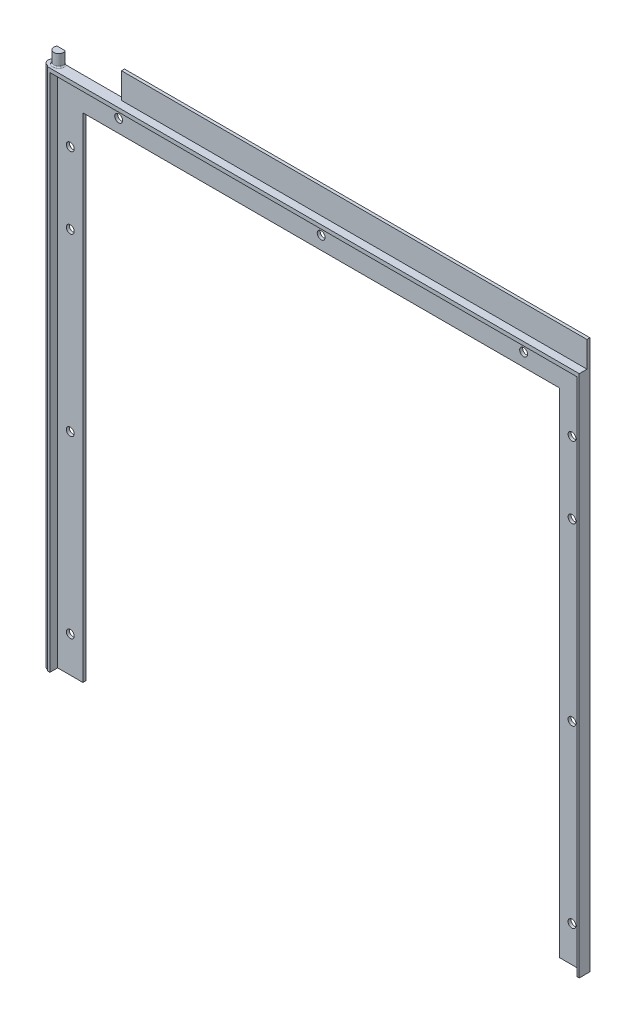
from build123d import *

# Parameters (mm, degrees)
SALIENTE_EXTRUIR1_DEPTH = 1.25
SALIENTE_EXTRUIR2_DEPTH = 3.25
SALIENTE_EXTRUIR3_DEPTH = 219.699982554
SALIENTE_EXTRUIR4_DEPTH = 5
REDONDEO1_R             = 0.5
CROQUIS7_R              = 1.65
CORTAR_EXTRUIR1_DEPTH   = 409.725190141


with BuildPart() as part:
    # Croquis1 → Saliente-Extruir1 (new body)
    with BuildSketch(Plane.XY):
        Polygon((76.151803136, 59.751000255), (76.151803136, 266.850888729), (276.149988174, 266.850888729), (276.149988174, 59.751000255), (287.750005722, 59.751000255), (287.750005722, 290.251016617), (92.349797487, 290.251016617), (92.349797487, 279.450982809), (64.949996769, 279.450982809), (64.439042354, 59.751000255), align=None)
    extrude(amount=SALIENTE_EXTRUIR1_DEPTH)

    # Croquis3 → Saliente-Extruir2 (add)
    with BuildSketch(Plane.XY.offset(1.25)):
        Polygon((65.549881, 59.751000255), (65.549881, 277.83340256), (286.749988794, 277.845112205), (286.751151675, 59.751000255), (287.750005722, 59.751000255), (287.750005722, 279.450982809), (92.349797487, 279.450982809), (64.949996769, 279.450982809), (64.439042354, 59.751000255), align=None)
    extrude(amount=SALIENTE_EXTRUIR2_DEPTH)

    # Croquis4 → Saliente-Extruir3 (add)
    with BuildSketch(Plane(origin=(0, 279.450982809, 0), x_dir=(1, 0, 0), z_dir=(0, 1, 0))):
        with BuildLine():
            Line((64.20314146, -3.994108901), (64.439042354, -4.5))
            Line((64.439042354, -4.5), (64.949996769, -4.5))
            Line((64.949996769, -4.5), (64.949996769, 0))
            Line((64.949996769, 0), (64.159257759, 0))
            ThreePointArc((64.159257759, 0), (62.250455442, -2.018267743), (64.20314146, -3.994108901))
        make_face()
    extrude(amount=-SALIENTE_EXTRUIR3_DEPTH)

    # Croquis6 → Saliente-Extruir4 (add)
    with BuildSketch(Plane(origin=(0, 279.450982809, 0), x_dir=(1, 0, 0), z_dir=(0, 1, 0))):
        with BuildLine():
            Line((67.471777384, 0), (64.029912079, 0))
            ThreePointArc((64.029912079, 0), (65.750844731, -3.019014625), (67.471777384, 0))
        make_face()
    extrude(amount=SALIENTE_EXTRUIR4_DEPTH)

    # Redondeo1
    redondeo1_edges = [part.edges().sort_by_distance(p)[0] for p in [
        (65.757057169, 279.450982809, 3.019004976),
    ]]
    fillet(redondeo1_edges, radius=REDONDEO1_R)

    # Croquis7 → Cortar-Extruir1 (cut, through all)
    with BuildSketch(Plane.XY.offset(1.25)):
        with Locations((70.850842068, 74.751000255)):
            Circle(CROQUIS7_R)
        with Locations((70.850842068, 251.850888729)):
            Circle(CROQUIS7_R)
        with Locations((70.850842068, 221.850888729)):
            Circle(CROQUIS7_R)
        with Locations((70.850842068, 148.300944492)):
            Circle(CROQUIS7_R)
        with Locations((91.151803136, 272.342426261)):
            Circle(CROQUIS7_R)
        with Locations((176.149949567, 272.342426261)):
            Circle(CROQUIS7_R)
        with Locations((261.148095998, 272.342426261)):
            Circle(CROQUIS7_R)
        with Locations((281.449057067, 251.850888729)):
            Circle(CROQUIS7_R)
        with Locations((281.449057067, 221.850888729)):
            Circle(CROQUIS7_R)
        with Locations((281.449057067, 148.300944492)):
            Circle(CROQUIS7_R)
        with Locations((281.449057067, 74.751000255)):
            Circle(CROQUIS7_R)
    extrude(amount=-CORTAR_EXTRUIR1_DEPTH, mode=Mode.SUBTRACT)


solid = part.part
